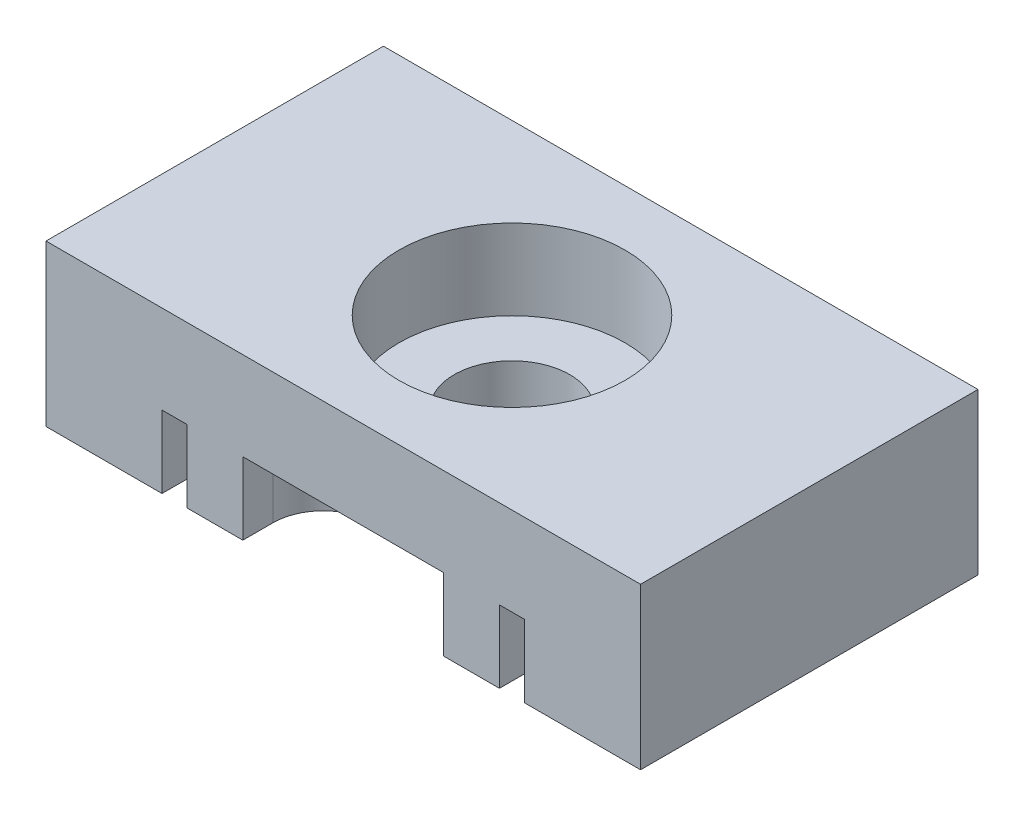
from build123d import *

# Parameters (mm, degrees)
SKETCH1_W               = 18.796
SKETCH1_H               = 10.668
BASE_DEPTH              = 5.08
BOXSLOTS_DEPTH          = 2.286
MOUTINGHOLE_D           = 3.6576
MOUTINGHOLE_CBORE_D     = 7.14502
MOUTINGHOLE_CBORE_DEPTH = 2.54
CUT_EXTRUDE1_DEPTH      = 2.286


with BuildPart() as part:
    # Sketch1 → Base (new body)
    with BuildSketch(Plane(origin=(0, 0, 0), x_dir=(1, 0, 0), z_dir=(0, 1, 0))):
        Rectangle(SKETCH1_W, SKETCH1_H)
    extrude(amount=BASE_DEPTH)

    # Sketch2 → BoxSlots (cut)
    with BuildSketch(Plane.XZ):
        with BuildLine():
            Line((-4.937125, 5.334), (-4.937125, 3.8608))
            ThreePointArc((-4.937125, 3.8608), (-5.334, 3.463925), (-5.730875, 3.8608))
            Line((-5.730875, 3.8608), (-5.730875, 5.334))
            ThreePointArc((-5.730875, 5.334), (-5.334, 5.730875), (-4.937125, 5.334))
        make_face()
        with BuildLine():
            Line((5.730875, 5.334), (5.730875, 3.8608))
            ThreePointArc((5.730875, 3.8608), (5.334, 3.463925), (4.937125, 3.8608))
            Line((4.937125, 3.8608), (4.937125, 5.334))
            ThreePointArc((4.937125, 5.334), (5.334, 5.730875), (5.730875, 5.334))
        make_face()
    extrude(amount=-BOXSLOTS_DEPTH, mode=Mode.SUBTRACT)

    # MoutingHole (through all)
    with Locations(Plane(origin=(0, 5.08, 0), x_dir=(1, 0, 0), z_dir=(0, 1, 0))):
        with Locations((0, 0)):
            CounterBoreHole(MOUTINGHOLE_D / 2, MOUTINGHOLE_CBORE_D / 2, MOUTINGHOLE_CBORE_DEPTH)

    # Sketch7 → Cut-Extrude1 (cut)
    with BuildSketch(Plane.XZ):
        with BuildLine():
            Line((-3.175, 5.334), (3.175, 5.334))
            Line((3.175, 5.334), (3.175, 4.3815))
            ThreePointArc((3.175, 4.3815), (2.710032015, 3.258967985), (1.5875, 2.794))
            Line((1.5875, 2.794), (-1.5875, 2.794))
            ThreePointArc((-1.5875, 2.794), (-2.710032015, 3.258967985), (-3.175, 4.3815))
            Line((-3.175, 4.3815), (-3.175, 5.334))
        make_face()
    extrude(amount=-CUT_EXTRUDE1_DEPTH, mode=Mode.SUBTRACT)


solid = part.part
